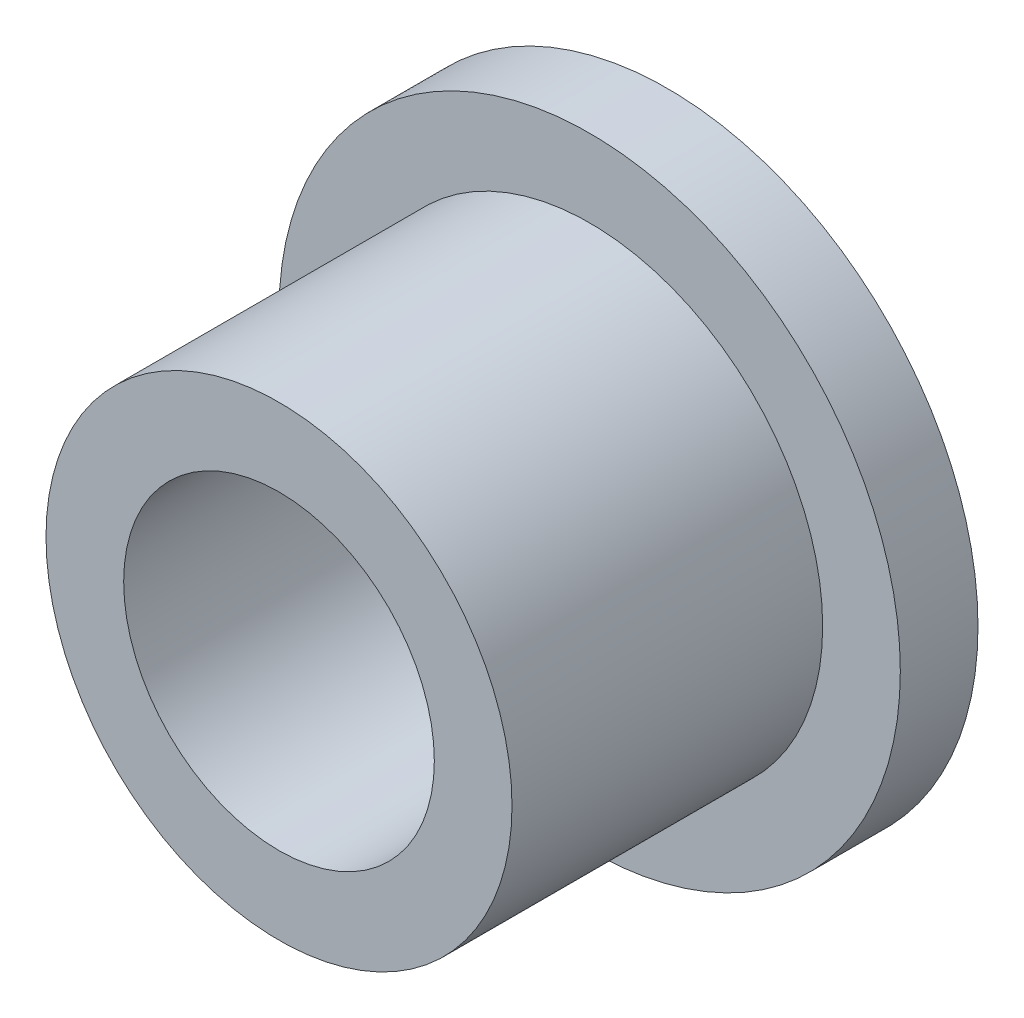
from build123d import *

# Parameters (mm, degrees)
SKETCH1_R           = 6.35
SKETCH1_R_2         = 3.175
BOSS_EXTRUDE1_DEPTH = 1.5875
SKETCH2_R           = 4.7625
SKETCH2_R_2         = 3.175
BOSS_EXTRUDE2_DEPTH = 6.35


with BuildPart() as part:
    # Sketch1 → Boss-Extrude1 (new body)
    with BuildSketch(Plane.XY):
        Circle(SKETCH1_R)
        Circle(SKETCH1_R_2, mode=Mode.SUBTRACT)
    extrude(amount=BOSS_EXTRUDE1_DEPTH)

    # Sketch2 → Boss-Extrude2 (add)
    with BuildSketch(Plane.XY.offset(1.5875)):
        Circle(SKETCH2_R)
        Circle(SKETCH2_R_2, mode=Mode.SUBTRACT)
    extrude(amount=BOSS_EXTRUDE2_DEPTH)


solid = part.part
